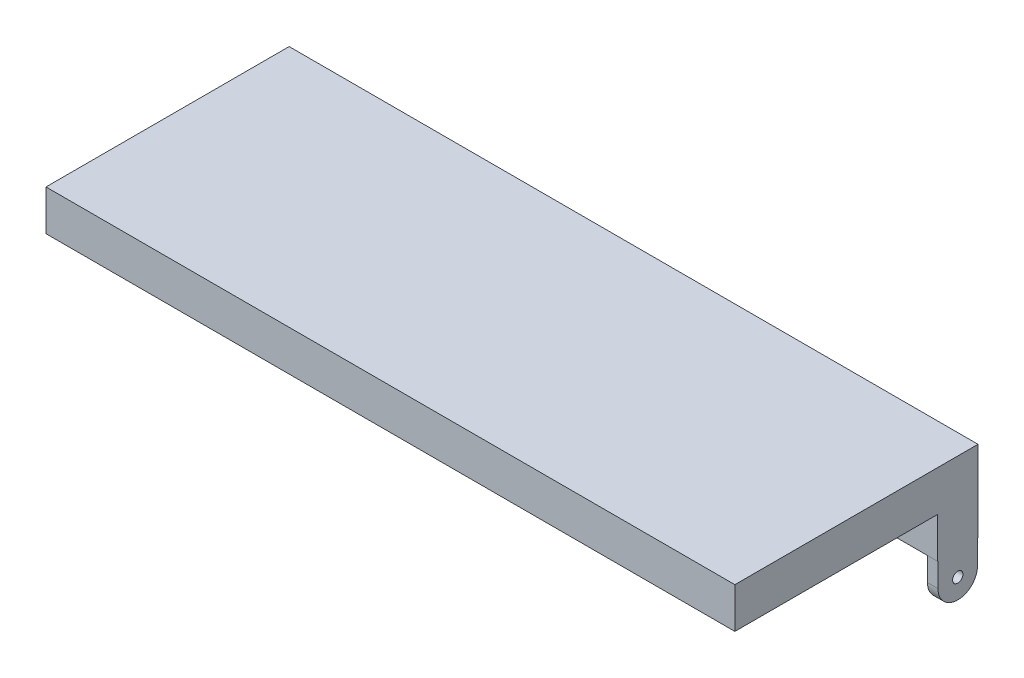
from build123d import *

# Parameters (mm, degrees)
SKETCH1_W             = 85
SKETCH1_H             = 30
TOP_SURFACE_DEPTH     = 10
SKETCH6_W             = 25
SKETCH6_H             = 5
TOP_SURFACE_CUT_DEPTH = 91.691785736
SKETCH8_R             = 0.64
BOSS_EXTRUDE2_DEPTH   = 1.3
LPATTERN2_COUNT       = 2
LPATTERN2_PITCH       = 83.7


with BuildPart() as part:
    # Sketch1 → Top surface (new body)
    with BuildSketch(Plane(origin=(0, 0, 0), x_dir=(1, 0, 0), z_dir=(0, 1, 0))):
        with Locations((42.5, 15)):
            Rectangle(SKETCH1_W, SKETCH1_H)
    extrude(amount=TOP_SURFACE_DEPTH)

    # Sketch6 → Top surface cut (cut, through all)
    with BuildSketch(Plane.ZY):
        with Locations((-12.5, 2.5)):
            Rectangle(SKETCH6_W, SKETCH6_H)
    extrude(amount=-TOP_SURFACE_CUT_DEPTH, mode=Mode.SUBTRACT)


with BuildPart() as part_1:
    # Body-Move/Copy1: moved
    add(part.part.moved(Location((0, 9.984827234, 0))))

    # Sketch8 → Boss-Extrude2 (add)
    with BuildSketch(Plane.ZY):
        with BuildLine():
            Line((-25.06, 9.984827234), (-29.94, 9.984827234))
            Line((-29.94, 9.984827234), (-29.94, 7.034827234))
            ThreePointArc((-29.94, 7.034827234), (-27.5, 4.594827234), (-25.06, 7.034827234))
            Line((-25.06, 7.034827234), (-25.06, 9.984827234))
        make_face()
        with Locations((-27.5, 7.034827234)):
            Circle(SKETCH8_R, mode=Mode.SUBTRACT)
    boss_extrude2 = extrude(amount=-BOSS_EXTRUDE2_DEPTH)

    # LPattern2: Boss-Extrude2 ×2
    with Locations(*[(i * LPATTERN2_PITCH, 0, 0) for i in range(1, LPATTERN2_COUNT)]):
        add(boss_extrude2)


solid = part_1.part
